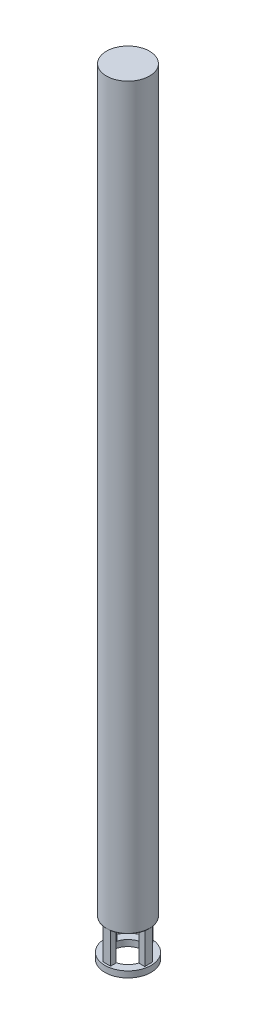
from build123d import *

# Parameters (mm, degrees)
ESQUISSE1_W                  = 3.5
ESQUISSE1_H                  = 120
BOSS_EXTRU_2_START           = -6
ESQUISSE6_R                  = 3.75
ESQUISSE6_R_2                = 2.5
BOSS_EXTRU_2_DEPTH           = 1
ESQUISSE7_W                  = 0.9
ESQUISSE7_H                  = 1.25
BOSS_EXTRU_3_DEPTH           = 5
R_P_TITION_CIRCULAIRE1_COUNT = 4
CONG_11_R                    = 0.1
ENL_V_START                  = -1
ESQUISSE10_R                 = 1.5
ENL_V_MAT_EXTRU_1_DEPTH      = 10


with BuildPart() as part:
    # Esquisse1 → Révolution1 (revolve)
    with BuildSketch(Plane.XY, mode=Mode.PRIVATE) as r_volution1_sk:
        with Locations((-1.75, 60)):
            Rectangle(ESQUISSE1_W, ESQUISSE1_H)
    revolve(r_volution1_sk.sketch.rotate(Axis((0, 0, 0), (0, 1, 0)), 270), axis=Axis((0, 0, 0), (0, 1, 0)))

    # Congé11
    cong_11_edges = [part.edges().sort_by_distance(p)[0] for p in [
        (0, 0, 3.5),
    ]]
    fillet(cong_11_edges, radius=CONG_11_R)

    # Esquisse10 → Enlèv. mat.-Extru.1 (cut)
    with BuildSketch(Plane(origin=(0, 0, 0), x_dir=(0, 0, -1), z_dir=(1, 0, 0)).offset(ENL_V_START)):
        with Locations((0, 104)):
            Circle(ESQUISSE10_R)
    extrude(amount=-ENL_V_MAT_EXTRU_1_DEPTH, mode=Mode.SUBTRACT)


with BuildPart() as body_2:
    # Esquisse6 → Boss.-Extru.2 (new body)
    with BuildSketch(Plane(origin=(0, 0, 0), x_dir=(1, 0, 0), z_dir=(0, 1, 0)).offset(BOSS_EXTRU_2_START)):
        with Locations(Location((0, 0, 0), (0, 0, 270))):
            Circle(ESQUISSE6_R)
        with Locations(Location((0, 0, 0), (0, 0, 270))):
            Circle(ESQUISSE6_R_2, mode=Mode.SUBTRACT)
    extrude(amount=BOSS_EXTRU_2_DEPTH)

    # Esquisse7 → Boss.-Extru.3 (add)
    with BuildSketch(Plane(origin=(0, 0, 0), x_dir=(1, 0, 0), z_dir=(0, 1, 0))):
        with Locations((2.95, -0.05)):
            Rectangle(ESQUISSE7_W, ESQUISSE7_H)
    boss_extru_3 = extrude(amount=-BOSS_EXTRU_3_DEPTH)

    # Répétition circulaire1: Boss.-Extru.3 ×4 about axis
    r_p_tition_circulaire1_axis = Axis((0, 0, 0), (0, 1, 0))
    for i in range(1, R_P_TITION_CIRCULAIRE1_COUNT):
        add(boss_extru_3.rotate(r_p_tition_circulaire1_axis, i * 360 / R_P_TITION_CIRCULAIRE1_COUNT))


solid = Compound([part.part, body_2.part])
